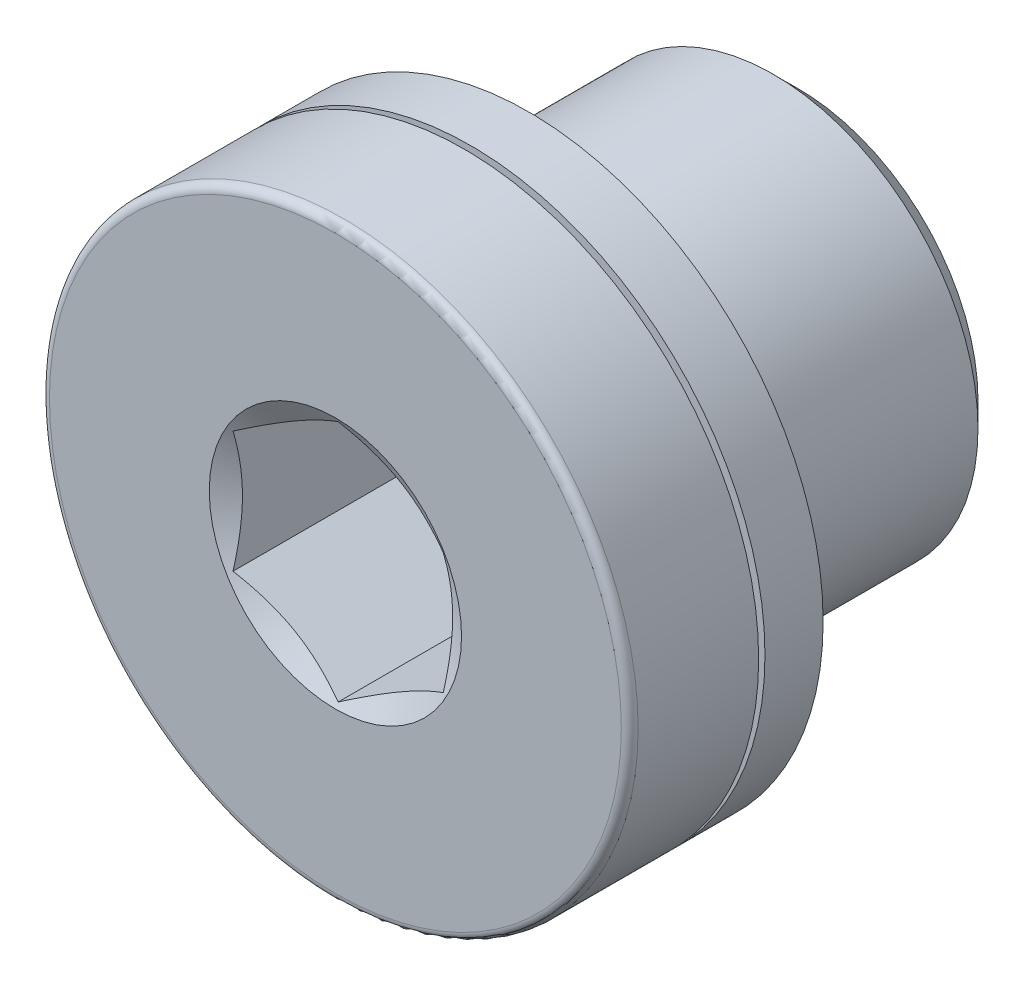
from build123d import *

# Parameters (mm, degrees)
SCHNITT_LINEAR_AUSTRAGEN1_DEPTH = 4.6


with BuildPart() as part:
    # Skizze1 → Rotation1 (revolve)
    with BuildSketch(Plane(origin=(0, 0, 0), x_dir=(0, 0, -1), z_dir=(1, 0, 0))):
        with BuildLine():
            Line((-2.867949192, 0), (-4.6, 3))
            Line((-4.6, 3), (-4.6, 6.8))
            ThreePointArc((-4.6, 6.8), (-4.541421356, 6.941421356), (-4.4, 7))
            Line((-4.4, 7), (-1.533333333, 7))
            Line((-1.533333333, 7), (-1.533333333, 6.3))
            Line((-1.533333333, 6.3), (-1.383333333, 6.3))
            Line((-1.383333333, 6.3), (-1.383333333, 7))
            Line((-1.383333333, 7), (0, 7))
            Line((0, 7), (0, 4.283))
            Line((0, 4.283), (0.581, 4.864))
            Line((0.581, 4.864), (5.819, 4.864))
            Line((5.819, 4.864), (6.4, 4.283))
            Line((6.4, 4.283), (6.4, 0))
            Line((6.4, 0), (-2.867949192, 0))
        make_face()
    revolve(axis=Axis((0, 0, -6.4), (0, 0, 1)))

    # Skizze2 → Schnitt-Linear austragen1 (cut)
    with BuildSketch(Plane.XY.offset(4.6)):
        Polygon((-2.5, -1.443375673), (0, -2.886751346), (2.5, -1.443375673), (2.5, 1.443375673), (0, 2.886751346), (-2.5, 1.443375673), align=None)
    extrude(amount=-SCHNITT_LINEAR_AUSTRAGEN1_DEPTH, mode=Mode.SUBTRACT)


solid = part.part
